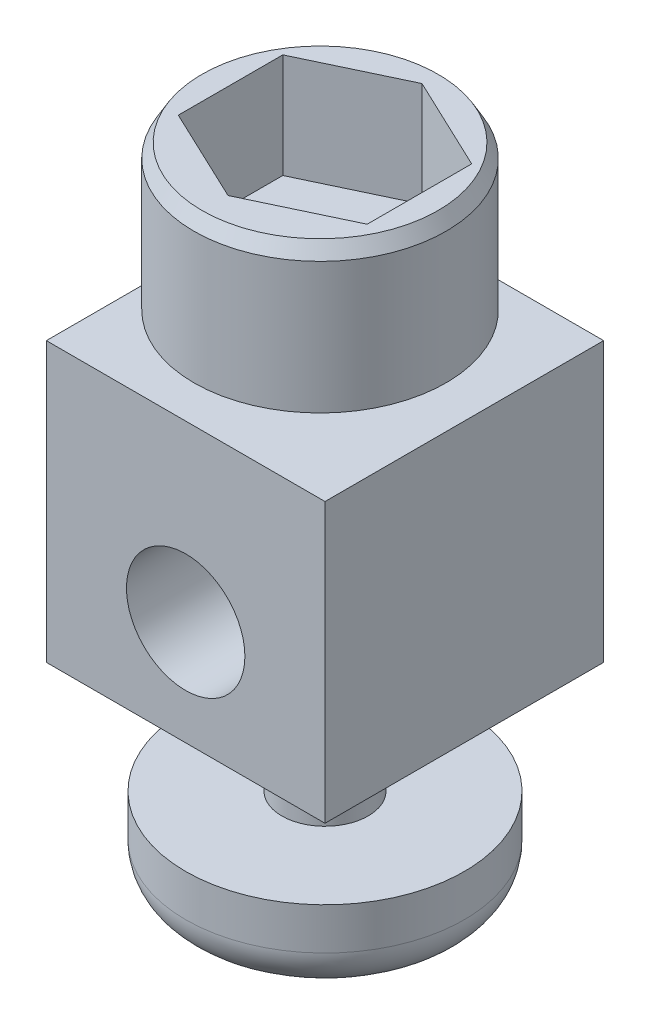
from build123d import *

# Parameters (mm, degrees)
SKETCH1_W          = 5.08
SKETCH1_H          = 5.08
EXTRUDE1_DEPTH     = 5.08
SKETCH2_R          = 1.0795
CUT_EXTRUDE1_DEPTH = 7.221703947
SKETCH3_R          = 0.7874
EXTRUDE2_DEPTH     = 4.0132
SKETCH4_R          = 1.3716
EXTRUDE3_DEPTH     = 3.175
SKETCH5_R          = 2.2987
EXTRUDE4_DEPTH     = 2.794
CHAMFER1_SIZE      = 0.254
CHAMFER1_SIZE2     = 0.146646968
CUT_EXTRUDE2_DEPTH = 1.905
CHAMFER2_SIZE      = 0.254
CHAMFER2_SIZE2     = 0.146646968


with BuildPart() as part:
    # Sketch1 → Extrude1 (new body)
    with BuildSketch(Plane.XY):
        Rectangle(SKETCH1_W, SKETCH1_H)
    extrude(amount=EXTRUDE1_DEPTH)

    # Sketch2 → Cut-Extrude1 (cut, through all)
    with BuildSketch(Plane.XY.offset(5.08)):
        with Locations((0, -0.635)):
            Circle(SKETCH2_R)
    extrude(amount=-CUT_EXTRUDE1_DEPTH, mode=Mode.SUBTRACT)

    # Sketch3 → Extrude2 (add)
    with BuildSketch(Plane.XZ.offset(2.54)):
        with Locations(Location((0, 2.54, 0), (0, 0, 180))):
            Circle(SKETCH3_R)
    extrude(amount=EXTRUDE2_DEPTH)

    # Sketch4 → Extrude3 (add)
    with BuildSketch(Plane(origin=(0, 2.54, 0), x_dir=(-1, 0, 0), z_dir=(0, 1, 0))):
        with Locations(Location((0, 2.630194731, 0), (0, 0, 270))):
            Circle(SKETCH4_R)
    extrude(amount=EXTRUDE3_DEPTH)

    # Sketch5 → Extrude4 (add)
    with BuildSketch(Plane(origin=(0, 5.715, 0), x_dir=(-1, 0, 0), z_dir=(0, 1, 0))):
        with Locations(Location((0, 2.630194731, 0), (0, 0, 90))):
            Circle(SKETCH5_R)
    extrude(amount=-EXTRUDE4_DEPTH)

    # Chamfer1
    chamfer1_edges = [part.edges().sort_by_distance(p)[0] for p in [
        (0, 5.715, 0.331494731),
    ]]
    chamfer1_side = [part.faces().sort_by_distance(p)[0] for p in [
        (0, 4.318, 0.331494731),
    ]]
    chamfer(chamfer1_edges, length=CHAMFER1_SIZE, length2=CHAMFER1_SIZE2, reference=chamfer1_side[0])

    # Sketch6 → Cut-Extrude2 (cut)
    with BuildSketch(Plane(origin=(0, 5.715, 0), x_dir=(-1, 0, 0), z_dir=(0, 1, 0))):
        Polygon((-1.721618465, 1.5875), (-1.721618465, 3.4925), (0, 4.308008959), (1.721756789, 3.49279208), (1.72148007, 1.5877921), (0, 0.771991041), align=None)
    extrude(amount=-CUT_EXTRUDE2_DEPTH, mode=Mode.SUBTRACT)

    # Chamfer2
    chamfer2_edges = [part.edges().sort_by_distance(p)[0] for p in [
        (0, 2.921, 0.331494731),
    ]]
    chamfer2_side = [part.faces().sort_by_distance(p)[0] for p in [
        (0, 2.921, 0.396511785),
    ]]
    chamfer(chamfer2_edges, length=CHAMFER2_SIZE, length2=CHAMFER2_SIZE2, reference=chamfer2_side[0])

    # Sketch9 → Revolve1 (revolve)
    with BuildSketch(Plane(origin=(-1.193288591, 0, 0.835302013), x_dir=(0.5734623443633287, 0, 0.8192319205190403), z_dir=(-0.8192319205190403, 0, 0.5734623443633287)), mode=Mode.PRIVATE) as revolve1_sk:
        with BuildLine():
            Line((2.080849078, -4.571424559), (-0.459150922, -4.571424559))
            Line((-0.459150922, -4.571424559), (-0.459150922, -5.333424559))
            ThreePointArc((-0.459150922, -5.333424559), (-0.235966289, -5.872239927), (0.302849078, -6.095424559))
            Line((0.302849078, -6.095424559), (2.080849078, -6.095424559))
            Line((2.080849078, -6.095424559), (2.080849078, -4.571424559))
        make_face()
    revolve(revolve1_sk.sketch.rotate(Axis((0, -4.571424559, 2.54), (0, -1, 0)), 304.992020199), axis=Axis((0, -4.571424559, 2.54), (0, -1, 0)))


solid = part.part
